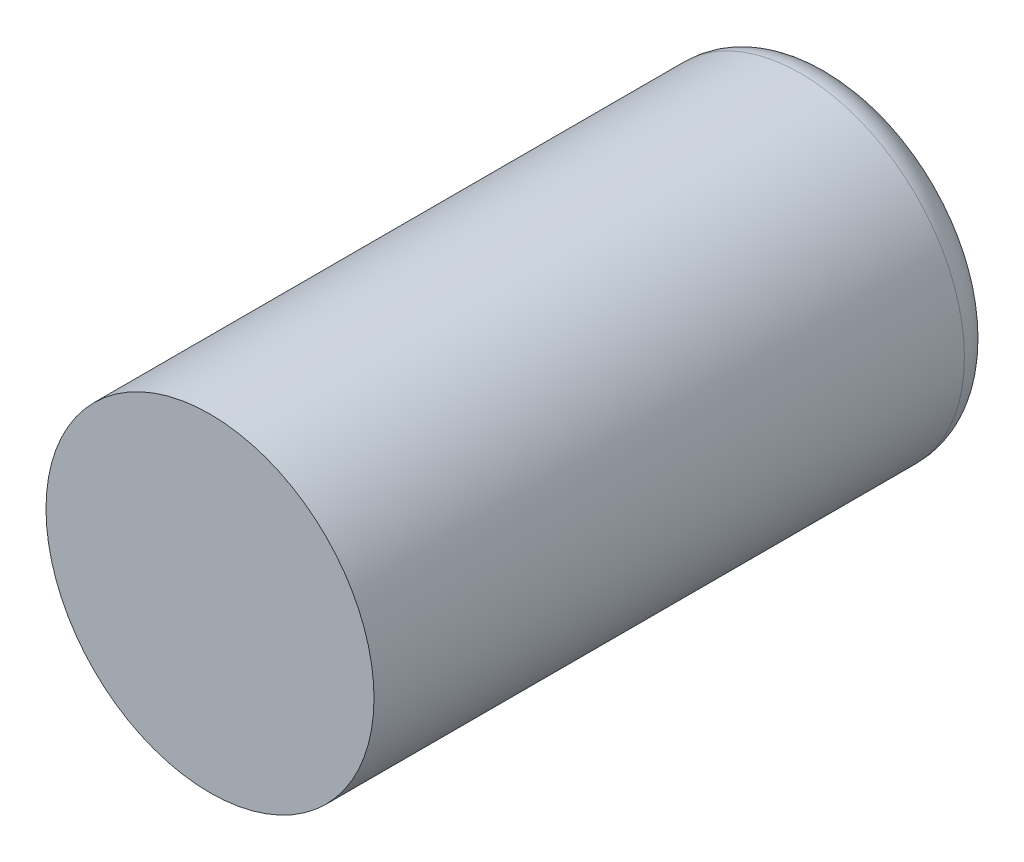
from build123d import *

# Parameters (mm, degrees)
SKIZZE1_R                       = 5
AUFSATZ_LINEAR_AUSTRAGEN1_DEPTH = 19
VERRUNDUNG1_R                   = 1


with BuildPart() as part:
    # Skizze1 → Aufsatz-Linear austragen1 (new body)
    with BuildSketch(Plane.XY):
        Circle(SKIZZE1_R)
    extrude(amount=AUFSATZ_LINEAR_AUSTRAGEN1_DEPTH)

    # Verrundung1
    verrundung1_edges = [part.edges().sort_by_distance(p)[0] for p in [
        (-5, 0, 0),
    ]]
    fillet(verrundung1_edges, radius=VERRUNDUNG1_R)


solid = part.part
